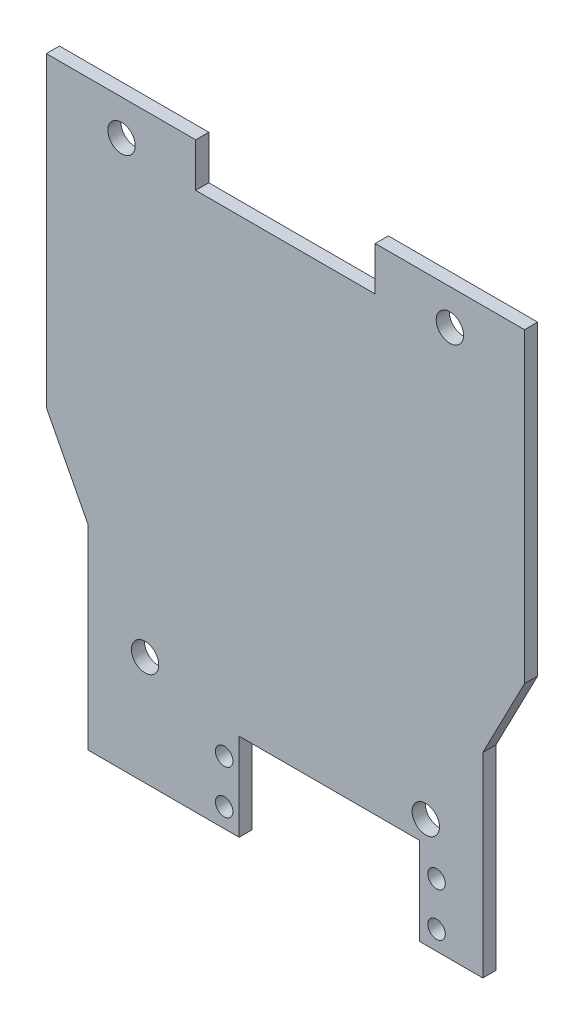
from build123d import *

# Parameters (mm, degrees)
SKETCH1_R           = 3.125
BOSS_EXTRUDE1_DEPTH = 3
SKETCH2_R           = 2
CUT_EXTRUDE1_DEPTH  = 3
SKETCH3_R           = 3.125
CUT_EXTRUDE2_DEPTH  = 3


with BuildPart() as part:
    # Sketch1 → Boss-Extrude1 (new body)
    with BuildSketch(Plane.XY):
        Polygon((-17.171078522, 8.102088167), (16.942973826, 8.102088167), (16.942973826, -1.897911833), (57.945, -1.897911833), (57.945, 8.102088167), (92.055, 8.102088167), (92.055, -61.897911833), (82.525114176, -80.288734737), (82.525114176, -124.897911833), (68.025114176, -124.897911833), (68.025114176, -104.897911833), (26.858807303, -104.897911833), (26.858807303, -124.897911833), (-7.641192697, -124.897911833), (-7.641192697, -80.288734737), (-17.171078522, -61.897911833), align=None)
        Circle(SKETCH1_R, mode=Mode.SUBTRACT)
        with Locations((75, 0)):
            Circle(SKETCH1_R, mode=Mode.SUBTRACT)
    extrude(amount=BOSS_EXTRUDE1_DEPTH)

    # Sketch2 → Cut-Extrude1 (cut)
    with BuildSketch(Plane.XY.offset(3)):
        with Locations((71.951514176, -120.540427833)):
            Circle(SKETCH2_R)
        with Locations((71.951514176, -110.541227833)):
            Circle(SKETCH2_R)
        with Locations((23.455105176, -120.540427833)):
            Circle(SKETCH2_R)
        with Locations((23.455105176, -110.541227833)):
            Circle(SKETCH2_R)
    extrude(amount=-CUT_EXTRUDE1_DEPTH, mode=Mode.SUBTRACT)

    # Sketch3 → Cut-Extrude2 (cut)
    with BuildSketch(Plane(origin=(0, 0, 0), x_dir=(-1, 0, 0), z_dir=(0, 0, -1))):
        with Locations((-69.500000176, -100.000011833)):
            Circle(SKETCH3_R)
        with Locations((-5.387973651, -100.000011833)):
            Circle(SKETCH3_R)
    extrude(amount=-CUT_EXTRUDE2_DEPTH, mode=Mode.SUBTRACT)


solid = part.part
